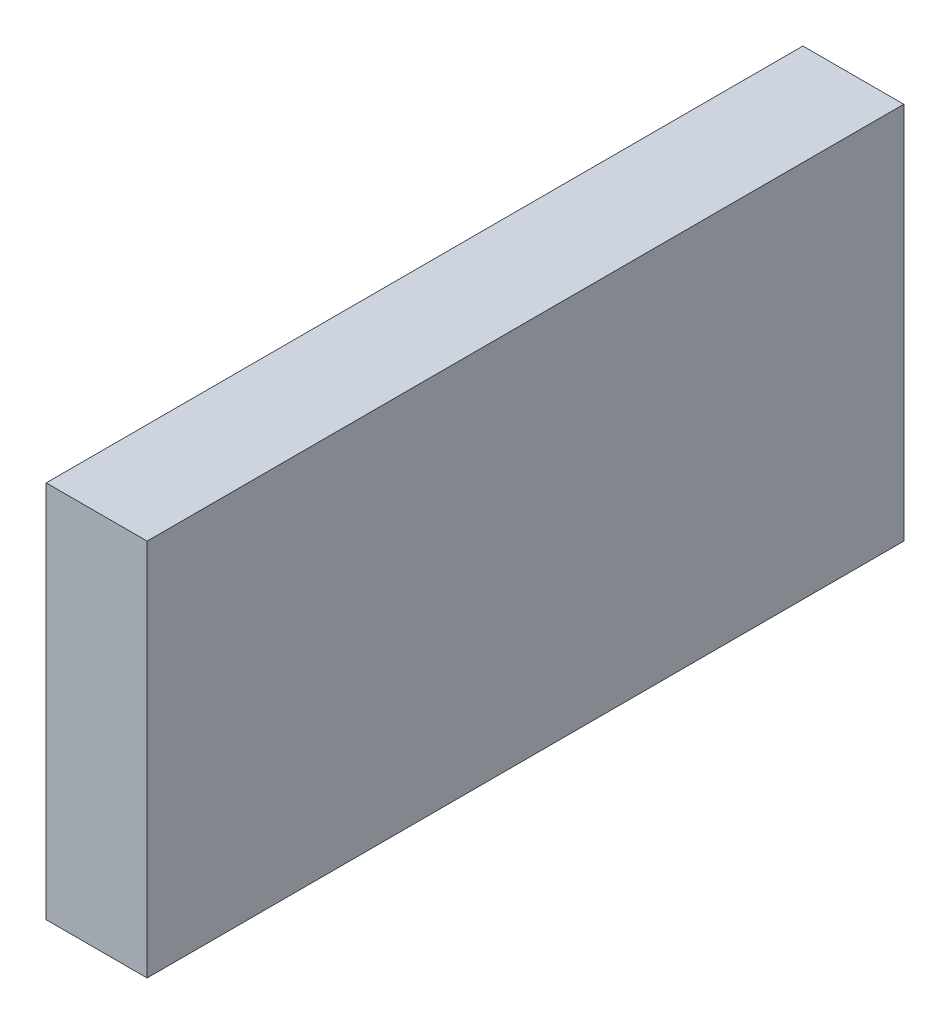
from build123d import *

# Parameters (mm, degrees)
SKETCH1_W           = 4
SKETCH1_H           = 15
BOSS_EXTRUDE1_DEPTH = 30


with BuildPart() as part:
    # Sketch1 → Boss-Extrude1 (new body)
    with BuildSketch(Plane.XY):
        Rectangle(SKETCH1_W, SKETCH1_H)
    extrude(amount=BOSS_EXTRUDE1_DEPTH)


solid = part.part
